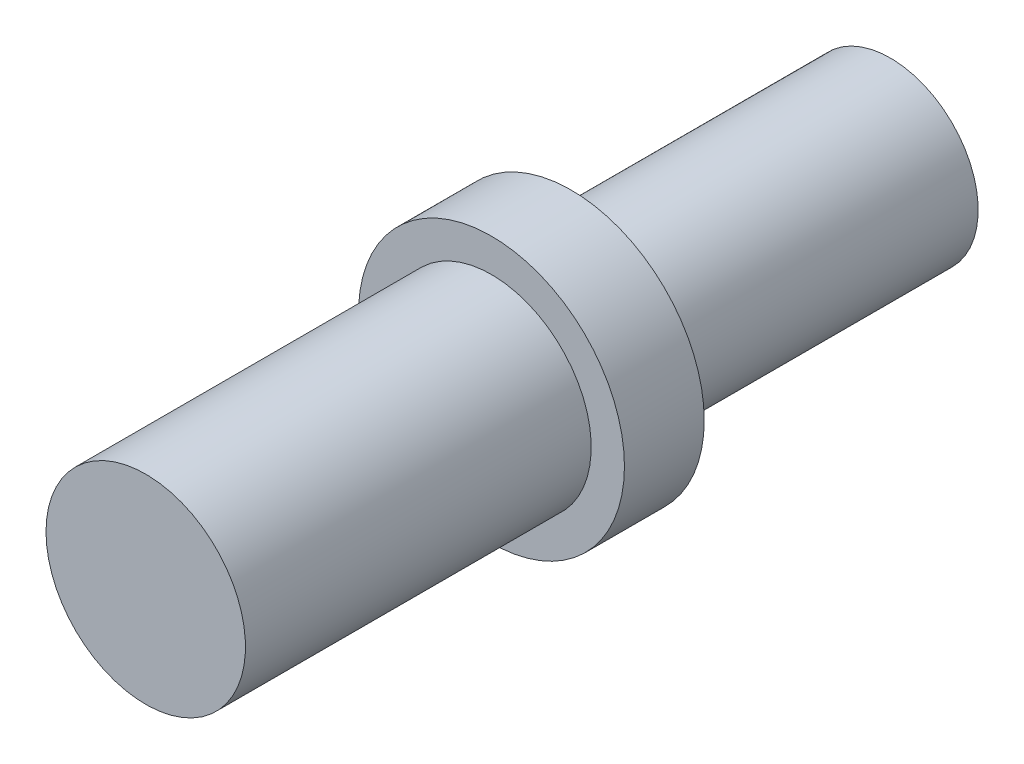
from build123d import *

# Parameters (mm, degrees)
SKETCH_1_R      = 5
EXTRUDE_1_DEPTH = 3
SKETCH_2_R      = 3.3
EXTRUDE_2_DEPTH = 12
SKETCH_4_R      = 3.75
EXTRUDE_3_DEPTH = 13


with BuildPart() as part:
    # 草圖1 → 填料-伸長1 (new body)
    with BuildSketch(Plane.XY):
        with Locations((-36.565519845, -95.307444045)):
            Circle(SKETCH_1_R)
    extrude(amount=EXTRUDE_1_DEPTH)

    # 草圖2 → 填料-伸長2 (add)
    with BuildSketch(Plane(origin=(0, 0, 0), x_dir=(-1, 0, 0), z_dir=(0, 0, -1))):
        with Locations((36.565519845, -95.307444045)):
            Circle(SKETCH_2_R)
    extrude(amount=EXTRUDE_2_DEPTH)

    # 草圖4 → 填料-伸長3 (add)
    with BuildSketch(Plane.XY.offset(3)):
        with Locations(Location((-36.565519845, -95.307444045, 0), (0, 0, 180))):
            Circle(SKETCH_4_R)
    extrude(amount=EXTRUDE_3_DEPTH)


solid = part.part
